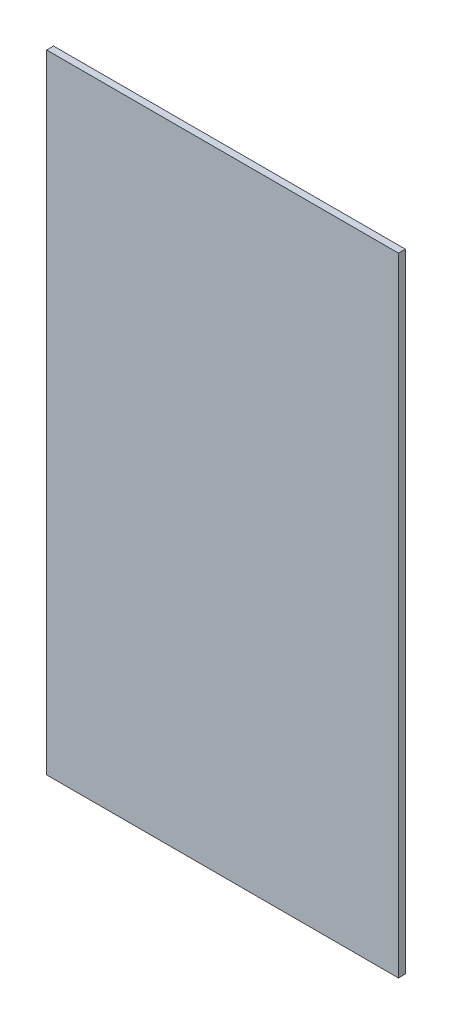
from build123d import *

# Parameters (mm, degrees)
SKETCH1_W           = 255
SKETCH1_H           = 455
BOSS_EXTRUDE1_DEPTH = 5


with BuildPart() as part:
    # Sketch1 → Boss-Extrude1 (new body)
    with BuildSketch(Plane.XY):
        with Locations((150, 250)):
            Rectangle(SKETCH1_W, SKETCH1_H)
    extrude(amount=-BOSS_EXTRUDE1_DEPTH)


solid = part.part
